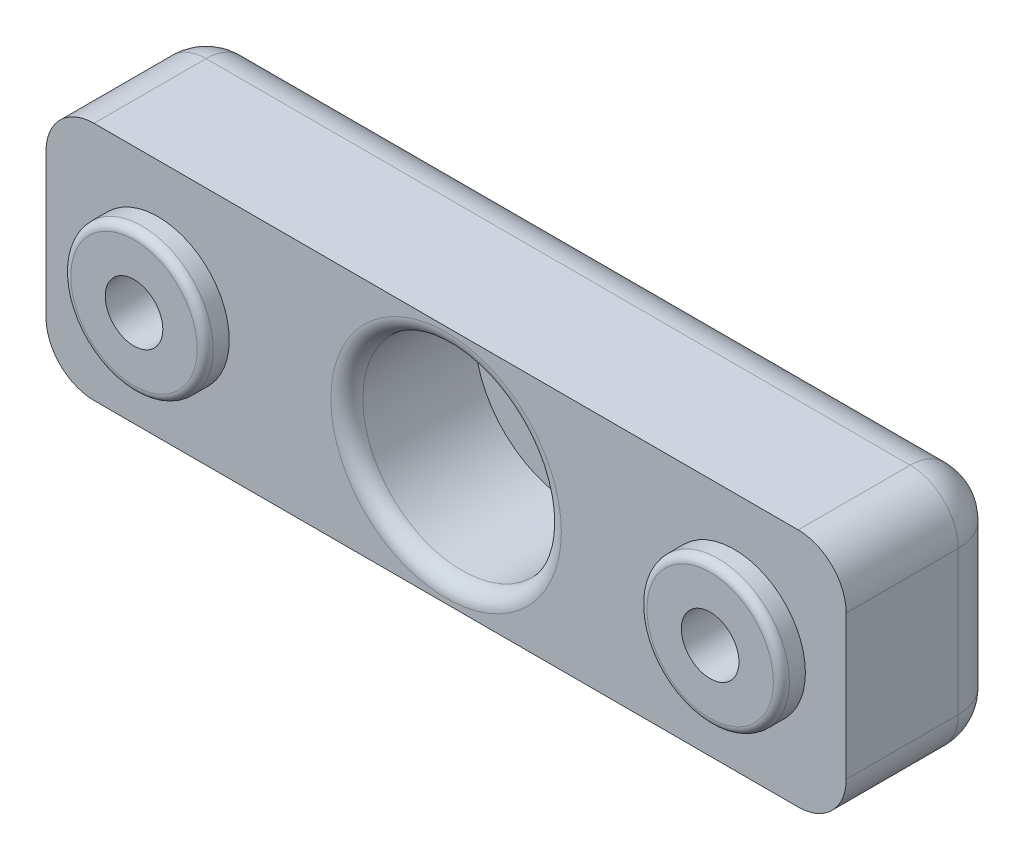
from build123d import *

# Parameters (mm, degrees)
CROQUIS1_W              = 50
CROQUIS1_H              = 15
SALIENTE_EXTRUIR1_DEPTH = 10
CROQUIS2_R              = 6.2
CROQUIS2_R_2            = 4.45
SALIENTE_EXTRUIR2_DEPTH = 1.5
CORTAR_EXTRUIR1_START   = -9.5
CROQUIS3_R              = 6.2
CORTAR_EXTRUIR1_DEPTH   = 9.5
CROQUIS4_R              = 1.8
CORTAR_EXTRUIR2_DEPTH   = 15.5
CORTAR_EXTRUIR3_DEPTH   = 3.5
REDONDEO1_R             = 3
REDONDEO2_R             = 1
REDONDEO3_R             = 0.5


with BuildPart() as part:
    # Croquis1 → Saliente-Extruir1 (new body)
    with BuildSketch(Plane.XY):
        with Locations((-2.430013275, 8.597922849)):
            Rectangle(CROQUIS1_W, CROQUIS1_H)
    extrude(amount=SALIENTE_EXTRUIR1_DEPTH)

    # Croquis2 → Saliente-Extruir2 (add)
    with BuildSketch(Plane.XY.offset(10)):
        with Locations((-2.430013275, 8.597922849)):
            Circle(CROQUIS2_R)
        with Locations((-20.430013275, 8.597922849)):
            Circle(CROQUIS2_R_2)
        with Locations((15.569986725, 8.597922849)):
            Circle(CROQUIS2_R_2)
    extrude(amount=SALIENTE_EXTRUIR2_DEPTH)

    # Croquis3 → Cortar-Extruir1 (cut)
    with BuildSketch(Plane.XY.offset(11.5).offset(CORTAR_EXTRUIR1_START)):
        with Locations((-2.430013275, 8.597922849)):
            Circle(CROQUIS3_R)
    extrude(amount=CORTAR_EXTRUIR1_DEPTH, mode=Mode.SUBTRACT)

    # Croquis4 → Cortar-Extruir2 (cut)
    with BuildSketch(Plane.XY.offset(11.5)):
        with Locations((-20.430013275, 8.597922849)):
            Circle(CROQUIS4_R)
        with Locations((15.569986725, 8.597922849)):
            Circle(CROQUIS4_R)
    extrude(amount=-CORTAR_EXTRUIR2_DEPTH, mode=Mode.SUBTRACT)

    # Croquis5 → Cortar-Extruir3 (cut)
    with BuildSketch(Plane(origin=(0, 0, 0), x_dir=(-1, 0, 0), z_dir=(0, 0, -1))):
        Polygon((-12.048150083, 8.597922849), (-13.809068404, 11.647922849), (-17.330905046, 11.647922849), (-19.091823367, 8.597922849), (-17.330905046, 5.547922849), (-13.809068404, 5.547922849), align=None)
        Polygon((23.951849917, 8.597922849), (22.190931596, 11.647922849), (18.669094954, 11.647922849), (16.908176633, 8.597922849), (18.669094954, 5.547922849), (22.190931596, 5.547922849), align=None)
    extrude(amount=-CORTAR_EXTRUIR3_DEPTH, mode=Mode.SUBTRACT)

    # Redondeo1
    redondeo1_edges = [part.edges().sort_by_distance(p)[0] for p in [
        (-2.430013275, 16.097922849, 0),
        (22.569986725, 8.597922849, 0),
        (-2.430013275, 1.097922849, 0),
        (-27.430013275, 8.597922849, 0),
        (-27.430013275, 16.097922849, 5),
        (22.569986725, 16.097922849, 5),
        (22.569986725, 1.097922849, 5),
        (-27.430013275, 1.097922849, 5),
    ]]
    fillet(redondeo1_edges, radius=REDONDEO1_R)

    # Redondeo2
    redondeo2_edges = [part.edges().sort_by_distance(p)[0] for p in [
        (-8.630013275, 8.597922849, 10),
    ]]
    fillet(redondeo2_edges, radius=REDONDEO2_R)

    # Redondeo3
    redondeo3_edges = [part.edges().sort_by_distance(p)[0] for p in [
        (-24.880013275, 8.597922849, 11.5),
        (11.119986725, 8.597922849, 11.5),
    ]]
    fillet(redondeo3_edges, radius=REDONDEO3_R)


solid = part.part
